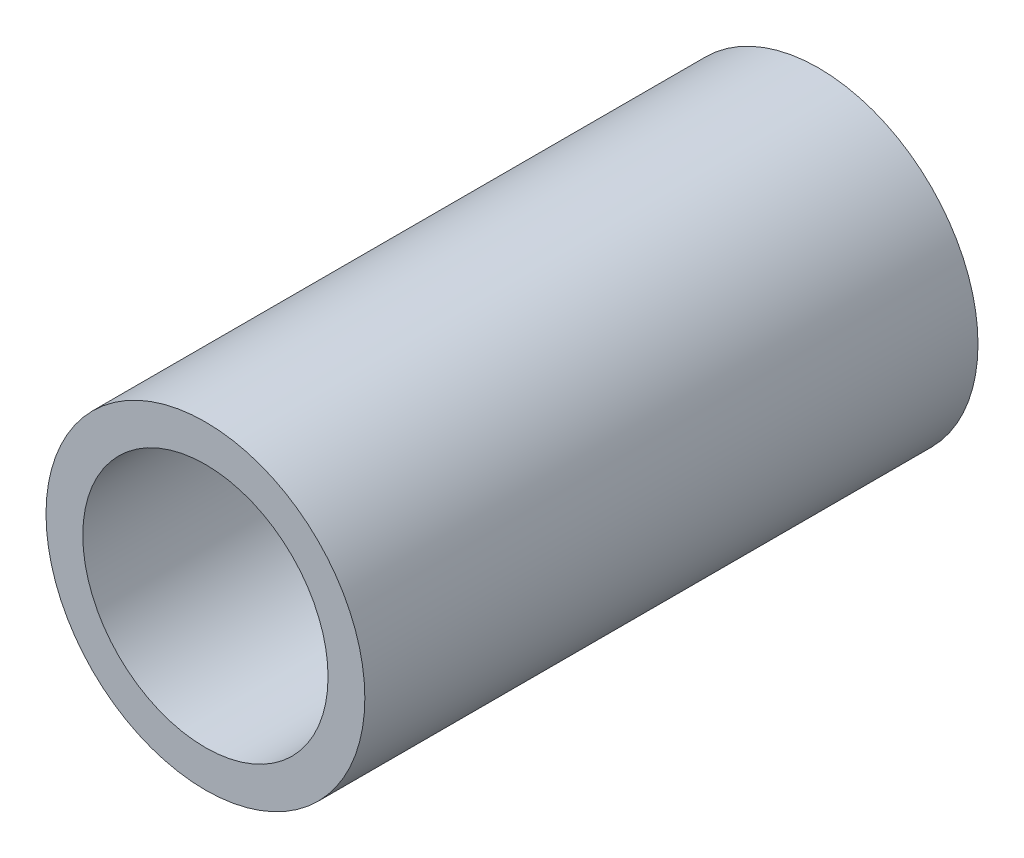
from build123d import *

# Parameters (mm, degrees)
SKETCH1_R           = 16.51
SKETCH1_R_2         = 12.7
BOSS_EXTRUDE1_DEPTH = 63.5


with BuildPart() as part:
    # Sketch1 → Boss-Extrude1 (new body)
    with BuildSketch(Plane.XY):
        Circle(SKETCH1_R)
        Circle(SKETCH1_R_2, mode=Mode.SUBTRACT)
    extrude(amount=BOSS_EXTRUDE1_DEPTH)


solid = part.part
